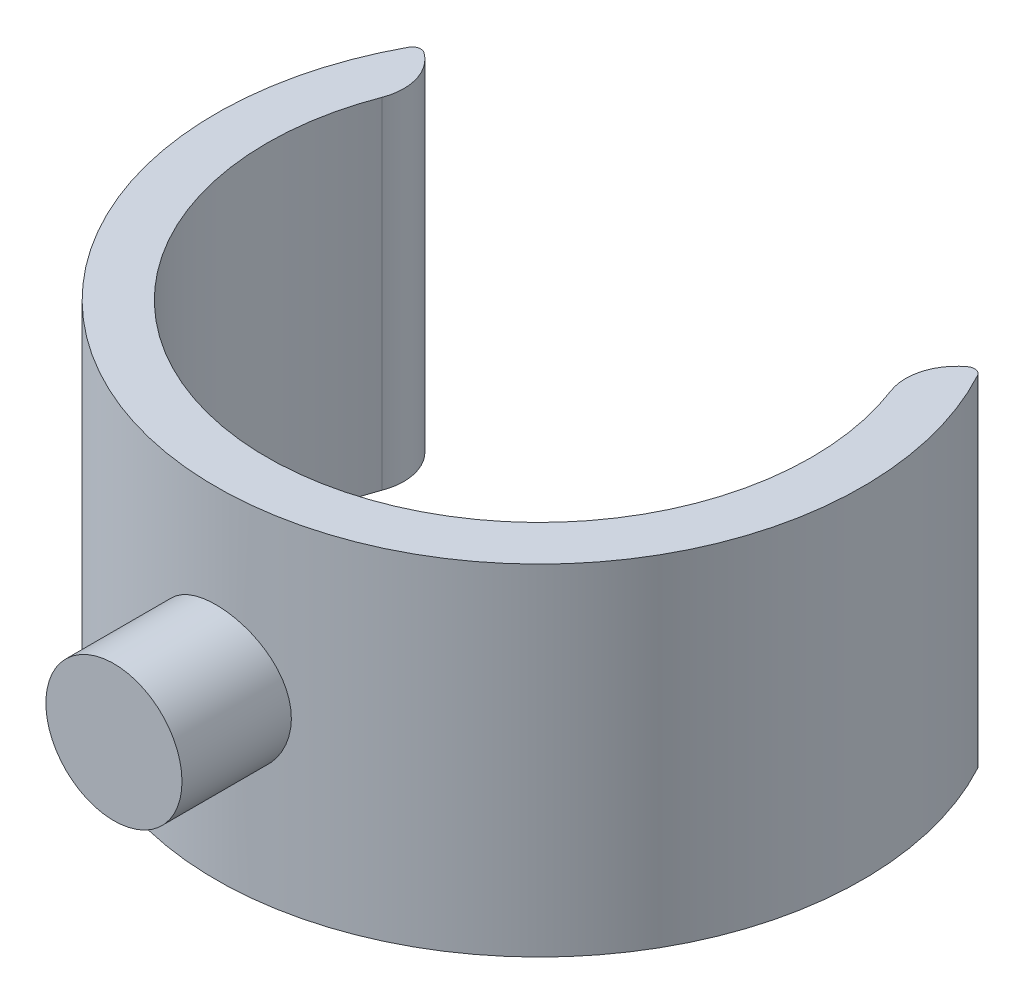
from build123d import *

# Parameters (mm, degrees)
EXTRUIR1_DEPTH      = 20
EXTRUIR2_REACH      = 60.496
EXTRUIR2_END_RADIUS = 19
EXTRUIR2_START      = 25
CROQUIS2_R          = 4
REDONDEO1_R         = 3
REDONDEO2_R         = 0.5


with BuildPart() as part:
    # Croquis1 → Extruir1 (new body)
    with BuildSketch(Plane(origin=(0, 0, 0), x_dir=(1, 0, 0), z_dir=(0, 1, 0))):
        with BuildLine():
            Line((16.454482672, 9.5), (13.856406461, 8))
            ThreePointArc((13.856406461, 8), (0, -16), (-13.856406461, 8))
            Line((-13.856406461, 8), (-16.454482672, 9.5))
            ThreePointArc((-16.454482672, 9.5), (0, -19), (16.454482672, 9.5))
        make_face()
    extrude(amount=EXTRUIR1_DEPTH)

    # Extruir2: up to this cylinder (the profile starts outside it)
    extruir2_end = Plane(origin=(0, 10, 0), z_dir=(0, -1, 0)) * Cylinder(EXTRUIR2_END_RADIUS, 159.992, mode=Mode.PRIVATE)
    # Croquis2 → Extruir2 (add, up to the surface)
    with BuildSketch(Plane.XY.offset(EXTRUIR2_START), mode=Mode.PRIVATE) as extruir2_sk1:
        with Locations((0, 10)):
            Circle(CROQUIS2_R)
    extruir2_tool1 = extrude(extruir2_sk1.sketch, amount=-EXTRUIR2_REACH, mode=Mode.PRIVATE) - extruir2_end
    add(extruir2_tool1.solids().sort_by_distance((0, 10, 25))[0])

    # Redondeo1
    redondeo1_edges = [part.edges().sort_by_distance(p)[0] for p in [
        (13.856406461, 10, -8),
        (-13.856406461, 10, -8),
    ]]
    fillet(redondeo1_edges, radius=REDONDEO1_R)

    # Redondeo2
    redondeo2_edges = [part.edges().sort_by_distance(p)[0] for p in [
        (16.454482672, 10, -9.5),
        (-16.454482672, 10, -9.5),
    ]]
    fillet(redondeo2_edges, radius=REDONDEO2_R)


solid = part.part
